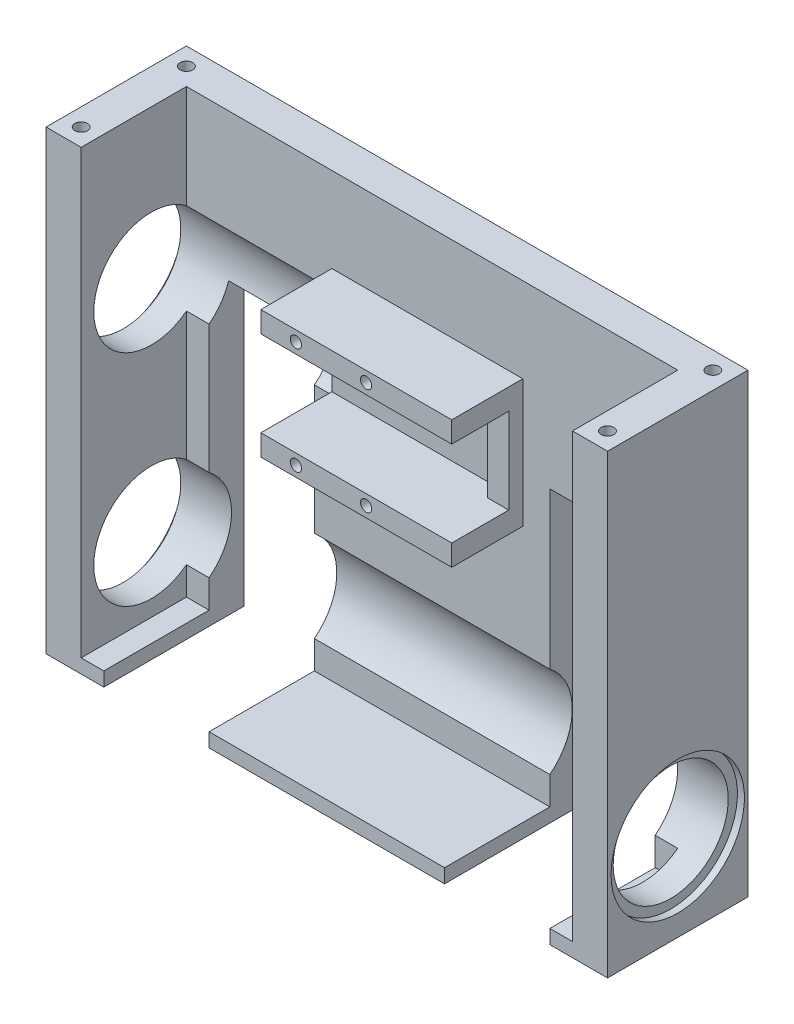
from build123d import *

# Parameters (mm, degrees)
SKETCH1_W                       = 80
SKETCH1_H                       = 65
BOSS_EXTRUDE1_DEPTH             = 20
SKETCH2_W                       = 70
SKETCH2_H                       = 61
CUT_EXTRUDE1_DEPTH              = 15
CUT_EXTRUDE7_REACH              = 80.899
SKETCH9_W                       = 70
SKETCH9_H                       = 15
BOSS_EXTRUDE2_DEPTH             = 10.125
SKETCH3_3_W                     = 3
SKETCH3_3_H                     = 6.1
BOSS_EXTRUDE3_DEPTH             = 2
TAP_DRILL_FOR_M2X0_4_TAP1_D     = 1.6
TAP_DRILL_FOR_M2X0_4_TAP1_DEPTH = 5
TAP_DRILL_FOR_M2X0_4_TAP1_TIP   = 0.480688495
CUT_EXTRUDE2_REACH              = 90.635
SKETCH7_R                       = 8.2
SKETCH7_3_R                     = 9.5
CUT_EXTRUDE3_DEPTH              = 1
SKETCH7_4_R                     = 8.2
CUT_EXTRUDE4_DEPTH              = 89.635489506
SKETCH7_5_R                     = 9.5
SKETCH7_5_R_2                   = 8.2
CUT_EXTRUDE5_DEPTH              = 1
CUT_EXTRUDE6_DEPTH              = 56.283360969
CUT_EXTRUDE6_DEPTH_BACK         = 56.283360969
SKETCH8_W                       = 15
SKETCH8_H                       = 57.5
TAP_DRILL_FOR_M2X0_4_TAP2_D     = 1.8
TAP_DRILL_FOR_M2X0_4_TAP2_DEPTH = 10
TAP_DRILL_FOR_M2X0_4_TAP2_TIP   = 0.540774557


with BuildPart() as part:
    # Sketch1 → Boss-Extrude1 (new body)
    with BuildSketch(Plane.XY):
        Rectangle(SKETCH1_W, SKETCH1_H)
    extrude(amount=BOSS_EXTRUDE1_DEPTH)

    # Sketch2 → Cut-Extrude1 (cut)
    with BuildSketch(Plane.XY.offset(20)):
        Rectangle(SKETCH2_W, SKETCH2_H)
    extrude(amount=-CUT_EXTRUDE1_DEPTH, mode=Mode.SUBTRACT)

    # Sketch9 → Cut-Extrude7 (cut, up to next)
    with BuildSketch(Plane(origin=(0, 32.5, 0), x_dir=(1, 0, 0), z_dir=(0, 1, 0)), mode=Mode.PRIVATE) as cut_extrude7_sk1:
        with Locations((0, -12.5)):
            Rectangle(SKETCH9_W, SKETCH9_H)
    cut_extrude7_tool1 = extrude(cut_extrude7_sk1.sketch, amount=-CUT_EXTRUDE7_REACH, mode=Mode.PRIVATE) & part.part
    add(cut_extrude7_tool1.solids().sort_by_distance((0, 32.5, 12.5))[0], mode=Mode.SUBTRACT)

    # Sketch3 → Boss-Extrude2 (add)
    with BuildSketch(Plane.XY.offset(5)):
        Polygon((12.923634865, 20.4), (-14.276365135, 20.4), (-14.276365135, 17.4), (9.923634865, 17.4), (12.923634865, 17.4), align=None)
        Polygon((12.923634865, 5.2), (9.923634865, 5.2), (-14.276365135, 5.2), (-14.276365135, 2.2), (12.923634865, 2.2), align=None)
    extrude(amount=BOSS_EXTRUDE2_DEPTH)

    # Sketch3<3> → Boss-Extrude3 (add)
    with BuildSketch(Plane.XY.offset(5)):
        with Locations((11.423634865, 14.35)):
            Rectangle(SKETCH3_3_W, SKETCH3_3_H)
        with Locations((11.423634865, 8.25)):
            Rectangle(SKETCH3_3_W, SKETCH3_3_H)
    extrude(amount=BOSS_EXTRUDE3_DEPTH)

    # Tap Drill for M2x0.4 Tap1
    with Locations(Plane.XY.offset(15.125)):
        with Locations((-9.276365135, 18.9), (0.723634865, 18.9), (0.723634865, 3.7), (-9.276365135, 3.7)):
            Hole(TAP_DRILL_FOR_M2X0_4_TAP1_D / 2, depth=TAP_DRILL_FOR_M2X0_4_TAP1_DEPTH)
            with Locations((0, 0, -(TAP_DRILL_FOR_M2X0_4_TAP1_DEPTH + TAP_DRILL_FOR_M2X0_4_TAP1_TIP / 2))):  # 118° drill point
                Cone(0, TAP_DRILL_FOR_M2X0_4_TAP1_D / 2, TAP_DRILL_FOR_M2X0_4_TAP1_TIP, mode=Mode.SUBTRACT)

    # Cut-Extrude2: up to this face of the body (flat: up to its plane)
    cut_extrude2_end = Plane(part.part.faces().sort_by_distance((-14.276365135, 18.9, 10.0625))[0])
    # Sketch7 → Cut-Extrude2 (cut, up to the picked face)
    with BuildSketch(Plane.ZY.offset(40), mode=Mode.PRIVATE) as cut_extrude2_sk1:
        with Locations((10, 11.3)):
            Circle(SKETCH7_R)
    cut_extrude2_tool1 = split(extrude(cut_extrude2_sk1.sketch, amount=-CUT_EXTRUDE2_REACH, mode=Mode.PRIVATE), bisect_by=cut_extrude2_end, keep=Keep.BOTH, mode=Mode.PRIVATE)
    add(cut_extrude2_tool1.solids().sort_by(Axis((-40, 11.3, 10), (1, 0, 0)))[0], mode=Mode.SUBTRACT)

    # Sketch7<3> → Cut-Extrude3 (cut)
    with BuildSketch(Plane.ZY.offset(40)):
        with Locations((10, 11.3)):
            Circle(SKETCH7_3_R)
    extrude(amount=-CUT_EXTRUDE3_DEPTH, mode=Mode.SUBTRACT)

    # Sketch7<4> → Cut-Extrude4 (cut, through all)
    with BuildSketch(Plane.ZY.offset(40)):
        with Locations((10, -20)):
            Circle(SKETCH7_4_R)
    extrude(amount=-CUT_EXTRUDE4_DEPTH, mode=Mode.SUBTRACT)

    # Sketch7<5> → Cut-Extrude5 (cut)
    with BuildSketch(Plane.ZY.offset(40)):
        with Locations((10, -20)):
            Circle(SKETCH7_5_R)
        with Locations((10, -20)):
            Circle(SKETCH7_5_R_2, mode=Mode.SUBTRACT)
    cut_extrude5 = extrude(amount=-CUT_EXTRUDE5_DEPTH, mode=Mode.SUBTRACT)

    # Mirror1: Cut-Extrude5 across plane
    add(cut_extrude5.mirror(Plane(origin=(0, 0, 0), x_dir=(0, 0, 1), z_dir=(1, 0, 0))), mode=Mode.SUBTRACT)

    # Sketch8 → Cut-Extrude6 (cut, two sides: drawn at the far end of the back side and taken through both)
    with BuildSketch(Plane(origin=(0, 0, 0), x_dir=(-1, 0, 0), z_dir=(0, 0, -1)).offset(-CUT_EXTRUDE6_DEPTH_BACK)):
        with Locations((24.276365135, -20)):
            Rectangle(SKETCH8_W, SKETCH8_H)
        with Locations((-24.276365135, -20)):
            Rectangle(SKETCH8_W, SKETCH8_H)
    extrude(amount=CUT_EXTRUDE6_DEPTH + CUT_EXTRUDE6_DEPTH_BACK, mode=Mode.SUBTRACT)

    # Tap Drill for M2x0.4 Tap2
    with Locations(Plane(origin=(0, 32.5, 0), x_dir=(1, 0, 0), z_dir=(0, 1, 0))):
        with Locations((-37.5, -17.5), (-37.5, -2.5), (37.5, -2.5), (37.5, -17.5)):
            Hole(TAP_DRILL_FOR_M2X0_4_TAP2_D / 2, depth=TAP_DRILL_FOR_M2X0_4_TAP2_DEPTH)
            with Locations((0, 0, -(TAP_DRILL_FOR_M2X0_4_TAP2_DEPTH + TAP_DRILL_FOR_M2X0_4_TAP2_TIP / 2))):  # 118° drill point
                Cone(0, TAP_DRILL_FOR_M2X0_4_TAP2_D / 2, TAP_DRILL_FOR_M2X0_4_TAP2_TIP, mode=Mode.SUBTRACT)


solid = part.part
